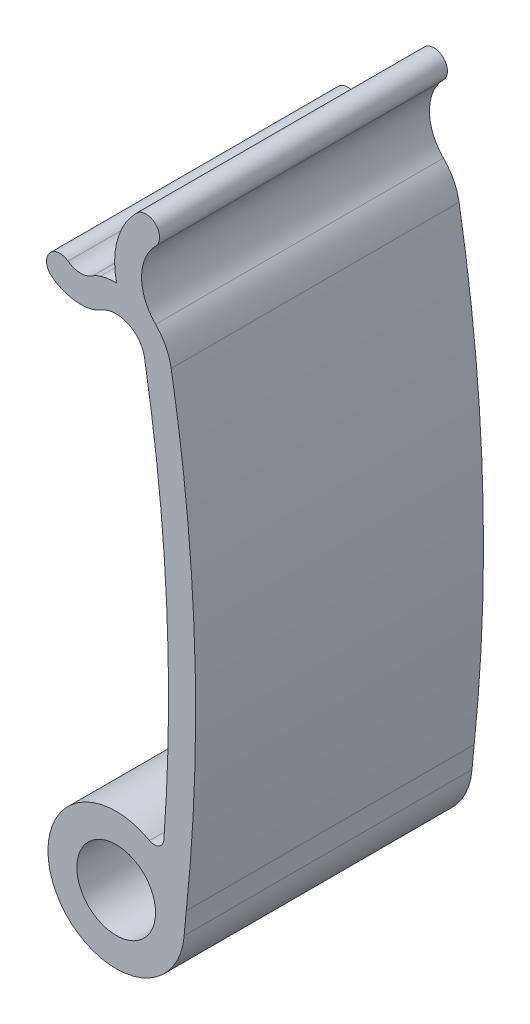
from build123d import *

# Parameters (mm, degrees)
SKETCH1_R           = 4.1
BOSS_EXTRUDE1_DEPTH = 30


with BuildPart() as part:
    # Sketch1 → Boss-Extrude1 (new body)
    with BuildSketch(Plane.XY):
        with BuildLine():
            ThreePointArc((2.121320344, 62.15218613), (0.128747602, 58.750955542), (0.053741668, 54.809751443))
            ThreePointArc((0.053741668, 54.809751443), (-0.804117699, 54.754085047), (-1.644372539, 54.572444612))
            ThreePointArc((-1.644372539, 54.572444612), (-2.072579341, 54.409614804), (-2.471000729, 54.183484289))
            ThreePointArc((-2.471000729, 54.183484289), (-3.749930813, 53.810707626), (-5.008263036, 54.248))
            ThreePointArc((-5.008263036, 54.248), (-6.975263036, 53.967), (-6.694263036, 52))
            ThreePointArc((-6.694263036, 52), (-5.044448782, 51.185750479), (-3.211825355, 51.023329036))
            ThreePointArc((-3.211825355, 51.023329036), (-2.346266102, 51.205491656), (-1.541903785, 51.573428203))
            ThreePointArc((-1.541903785, 51.573428203), (1.27066207, 51.717612537), (2.963447684, 49.46688095))
            ThreePointArc((2.963447684, 49.46688095), (5.265961581, 28.292845916), (4.96853298, 6.996065265))
            ThreePointArc((4.96853298, 6.996065265), (4.443724564, 6.189701484), (3.481666266, 6.199201562))
            ThreePointArc((3.481666266, 6.199201562), (-6.277419511, -3.338578183), (7.086411369, -0.578682913))
            ThreePointArc((7.086411369, -0.578682913), (7.189943669, 0.602744357), (7.307479638, 1.782860719))
            ThreePointArc((7.307479638, 1.782860719), (8.182981219, 25.916176913), (5.733322853, 49.940802351))
            ThreePointArc((5.733322853, 49.940802351), (5.169389034, 51.652077868), (4.108290399, 53.108290399))
            ThreePointArc((4.108290399, 53.108290399), (2.646753237, 56.636753237), (4.108290399, 60.165216075))
            ThreePointArc((4.108290399, 60.165216075), (4.108290399, 62.15218613), (2.121320344, 62.15218613))
        make_face()
        Circle(SKETCH1_R, mode=Mode.SUBTRACT)
    extrude(amount=BOSS_EXTRUDE1_DEPTH)


solid = part.part
